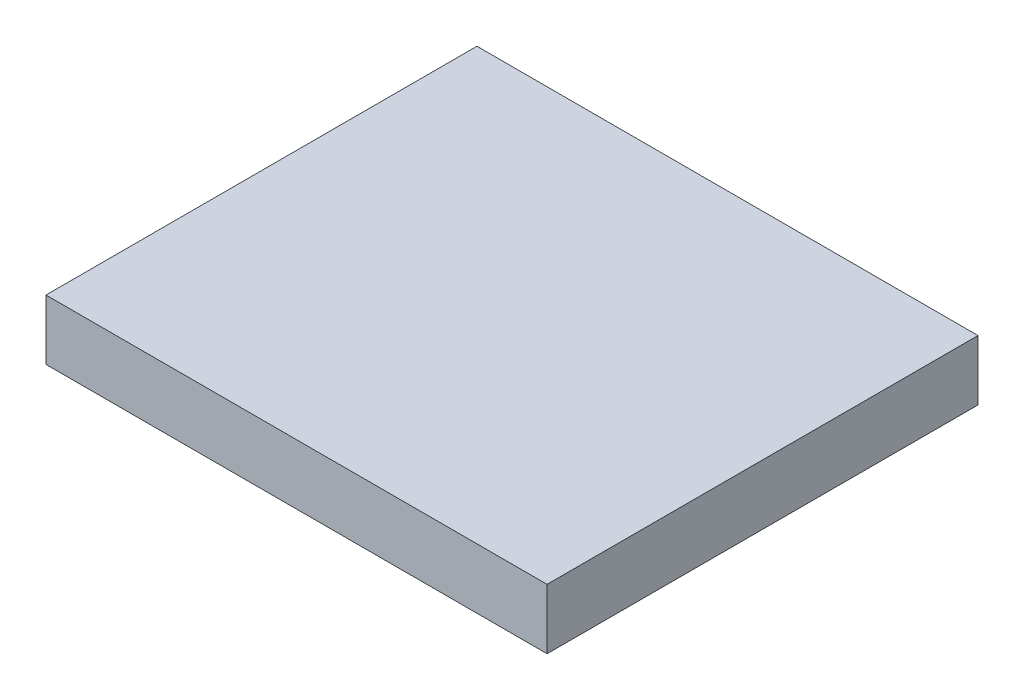
from build123d import *

# Parameters (mm, degrees)
SKETCH1_W           = 50
SKETCH1_H           = 43
BOSS_EXTRUDE1_DEPTH = 6


with BuildPart() as part:
    # Sketch1 → Boss-Extrude1 (new body)
    with BuildSketch(Plane(origin=(0, 0, 0), x_dir=(1, 0, 0), z_dir=(0, 1, 0))):
        Rectangle(SKETCH1_W, SKETCH1_H)
    extrude(amount=BOSS_EXTRUDE1_DEPTH)


solid = part.part
